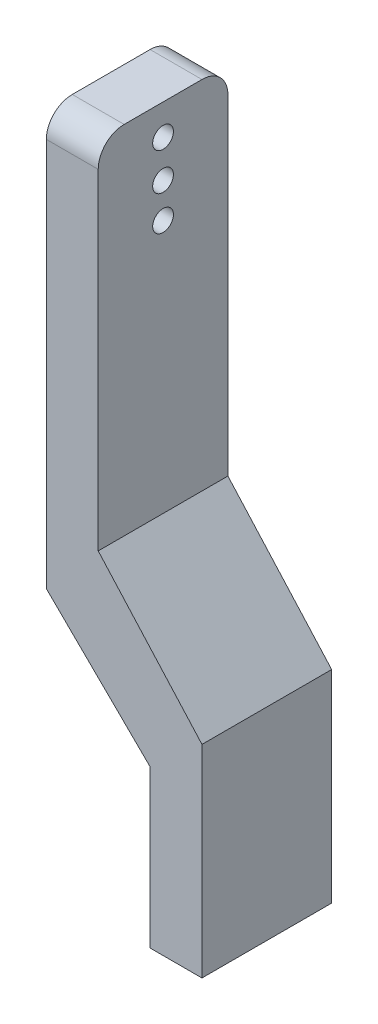
from build123d import *

# Parameters (mm, degrees)
Y_KSEKLIK_EKSTR_ZYON1_DEPTH = 25
KES_EKSTR_ZYON1_DEPTH       = 25
RADYUS1_R                   = 5
RADYUS2_R                   = 5


with BuildPart() as part:
    # Çizim1 → Yükseklik-Ekstrüzyon1 (new body)
    with BuildSketch(Plane.XY):
        Polygon((30, -11.002799306), (30, -50), (20, -50), (20, -19.736164581), (0, 0), (0, 80), (10, 80), (10, 11.297306062), align=None)
    extrude(amount=Y_KSEKLIK_EKSTR_ZYON1_DEPTH)

    # Çizim2 → Kes-Ekstrüzyon1 (cut)
    with BuildSketch(Plane.ZY):
        with BuildLine():
            ThreePointArc((14.5, 74.088859677), (13.914213562, 75.50307324), (12.5, 76.088859677))
            Line((12.5, 76.088859677), (12.5, 72.088859677))
            ThreePointArc((12.5, 72.088859677), (13.914213562, 72.674646115), (14.5, 74.088859677))
        make_face()
        with BuildLine():
            Line((12.5, 72.088859677), (12.5, 76.088859677))
            ThreePointArc((12.5, 76.088859677), (10.5, 74.088859677), (12.5, 72.088859677))
        make_face()
        with BuildLine():
            ThreePointArc((14.5, 66.903895924), (13.914213562, 68.318109486), (12.5, 68.903895924))
            Line((12.5, 68.903895924), (12.5, 64.903895924))
            ThreePointArc((12.5, 64.903895924), (13.914213562, 65.489682361), (14.5, 66.903895924))
        make_face()
        with BuildLine():
            Line((12.5, 64.903895924), (12.5, 68.903895924))
            ThreePointArc((12.5, 68.903895924), (10.5, 66.903895924), (12.5, 64.903895924))
        make_face()
        with BuildLine():
            ThreePointArc((12.5, 62.207705215), (10.5, 60.207705215), (12.5, 58.207705215))
            Line((12.5, 58.207705215), (12.5, 62.207705215))
        make_face()
        with BuildLine():
            Line((12.5, 62.207705215), (12.5, 58.207705215))
            ThreePointArc((12.5, 58.207705215), (13.914213562, 58.793491652), (14.5, 60.207705215))
            ThreePointArc((14.5, 60.207705215), (13.914213562, 61.621918777), (12.5, 62.207705215))
        make_face()
    extrude(amount=-KES_EKSTR_ZYON1_DEPTH, mode=Mode.SUBTRACT)

    # Radyus1
    radyus1_edges = [part.edges().sort_by_distance(p)[0] for p in [
        (5, 80, 25),
    ]]
    fillet(radyus1_edges, radius=RADYUS1_R)

    # Radyus2
    radyus2_edges = [part.edges().sort_by_distance(p)[0] for p in [
        (5, 80, 0),
    ]]
    fillet(radyus2_edges, radius=RADYUS2_R)


solid = part.part
